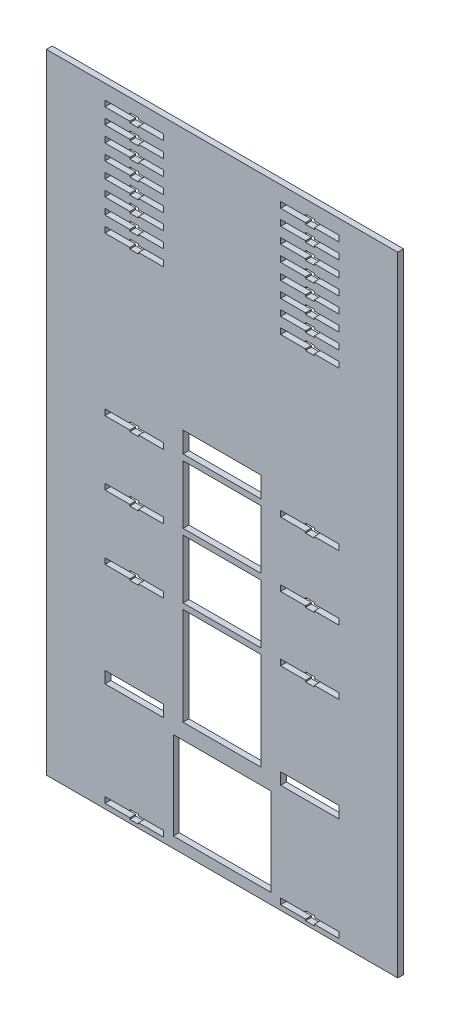
from build123d import *

# Parameters (mm, degrees)
SKETCH1_W                 = 180
SKETCH1_H                 = 322
SKETCH1_W_2               = 40
SKETCH1_H_2               = 130
SKETCH1_W_3               = 35
SKETCH1_H_3               = 27
PLATE_THICKNESS_3MM_DEPTH = 3
SKETCH2_W                 = 40
SKETCH2_H                 = 13.59171631
CUT_EXTRUDE1_DEPTH        = 15.24
SKETCH_1_W                = 50
SKETCH_1_H                = 45
CUT_EXTRUDE_1_DEPTH       = 255.576118283
SKETCH_2_W                = 40
SKETCH_2_H                = 3
SKETCH_2_H_2              = 2.910055408
SKETCH_2_H_3              = 8
EXTRUDE_1_DEPTH           = 3
SKETCH_3_W                = 30
SKETCH_3_H                = 6
CUT_EXTRUDE_2_DEPTH       = 255.576118283
SKETCH_3_3_W              = 4.5
SKETCH_3_3_H              = 0.75
EXTRUDE_2_DEPTH           = 3


with BuildPart() as part:
    # Sketch1 → Plate_thickness_3mm (new body)
    with BuildSketch(Plane.XY):
        with Locations((90, -19)):
            Rectangle(SKETCH1_W, SKETCH1_H)
        Polygon((30, -174.5), (30, -177.5), (42.75, -177.5), (42.75, -178.25), (47.25, -178.25), (47.25, -177.5), (60, -177.5), (60, -174.5), (47.25, -174.5), (47.25, -173.75), (42.75, -173.75), (42.75, -174.5), align=None, mode=Mode.SUBTRACT)
        Polygon((30, -121.5), (30, -124.5), (42.75, -124.5), (42.75, -125.25), (47.25, -125.25), (47.25, -124.5), (60, -124.5), (60, -121.5), (47.25, -121.5), (47.25, -120.75), (42.75, -120.75), (42.75, -121.5), align=None, mode=Mode.SUBTRACT)
        Polygon((30, -68.5), (30, -71.5), (42.75, -71.5), (42.75, -72.25), (47.25, -72.25), (47.25, -71.5), (60, -71.5), (60, -68.5), (47.25, -68.5), (47.25, -67.75), (42.75, -67.75), (42.75, -68.5), align=None, mode=Mode.SUBTRACT)
        Polygon((30, -35.5), (30, -38.5), (42.75, -38.5), (42.75, -39.25), (47.25, -39.25), (47.25, -38.5), (60, -38.5), (60, -35.5), (47.25, -35.5), (47.25, -34.75), (42.75, -34.75), (42.75, -35.5), align=None, mode=Mode.SUBTRACT)
        with Locations((90, -70.5)):
            Rectangle(SKETCH1_W_2, SKETCH1_H_2, mode=Mode.SUBTRACT)
        with Locations((90, -161)):
            Rectangle(SKETCH1_W_3, SKETCH1_H_3, mode=Mode.SUBTRACT)
        Polygon((120, -174.5), (120, -177.5), (132.75, -177.5), (132.75, -178.25), (137.25, -178.25), (137.25, -177.5), (150, -177.5), (150, -174.5), (137.25, -174.5), (137.25, -173.75), (132.75, -173.75), (132.75, -174.5), align=None, mode=Mode.SUBTRACT)
        Polygon((150, -121.5), (137.25, -121.5), (137.25, -120.75), (132.75, -120.75), (132.75, -121.5), (120, -121.5), (120, -124.5), (132.75, -124.5), (132.75, -125.25), (137.25, -125.25), (137.25, -124.5), (150, -124.5), align=None, mode=Mode.SUBTRACT)
        Polygon((150, -68.5), (137.25, -68.5), (137.25, -67.75), (132.75, -67.75), (132.75, -68.5), (120, -68.5), (120, -71.5), (132.75, -71.5), (132.75, -72.25), (137.25, -72.25), (137.25, -71.5), (150, -71.5), align=None, mode=Mode.SUBTRACT)
        Polygon((150, -35.5), (137.25, -35.5), (137.25, -34.75), (132.75, -34.75), (132.75, -35.5), (120, -35.5), (120, -38.5), (132.75, -38.5), (132.75, -39.25), (137.25, -39.25), (137.25, -38.5), (150, -38.5), align=None, mode=Mode.SUBTRACT)
        Polygon((30, -2.5), (30, -5.5), (42.75, -5.5), (42.75, -6.25), (47.25, -6.25), (47.25, -5.5), (60, -5.5), (60, -2.5), (47.25, -2.5), (47.25, -1.75), (42.75, -1.75), (42.75, -2.5), align=None, mode=Mode.SUBTRACT)
        Polygon((60, 75.5), (60, 78.5), (47.25, 78.5), (47.25, 79.25), (42.75, 79.25), (42.75, 78.5), (30, 78.5), (30, 75.5), (42.75, 75.5), (42.75, 74.75), (47.25, 74.75), (47.25, 75.5), align=None, mode=Mode.SUBTRACT)
        Polygon((60, 83.5), (60, 86.5), (47.25, 86.5), (47.25, 87.25), (42.75, 87.25), (42.75, 86.5), (30, 86.5), (30, 83.5), (42.75, 83.5), (42.75, 82.75), (47.25, 82.75), (47.25, 83.5), align=None, mode=Mode.SUBTRACT)
        Polygon((60, 91.5), (60, 94.5), (47.25, 94.5), (47.25, 95.25), (42.75, 95.25), (42.75, 94.5), (30, 94.5), (30, 91.5), (42.75, 91.5), (42.75, 90.75), (47.25, 90.75), (47.25, 91.5), align=None, mode=Mode.SUBTRACT)
        Polygon((60, 99.5), (60, 102.5), (47.25, 102.5), (47.25, 103.25), (42.75, 103.25), (42.75, 102.5), (30, 102.5), (30, 99.5), (42.75, 99.5), (42.75, 98.75), (47.25, 98.75), (47.25, 99.5), align=None, mode=Mode.SUBTRACT)
        Polygon((60, 107.5), (60, 110.5), (47.25, 110.5), (47.25, 111.25), (42.75, 111.25), (42.75, 110.5), (30, 110.5), (30, 107.5), (42.75, 107.5), (42.75, 106.75), (47.25, 106.75), (47.25, 107.5), align=None, mode=Mode.SUBTRACT)
        Polygon((60, 115.5), (60, 118.5), (47.25, 118.5), (47.25, 119.25), (42.75, 119.25), (42.75, 118.5), (30, 118.5), (30, 115.5), (42.75, 115.5), (42.75, 114.75), (47.25, 114.75), (47.25, 115.5), align=None, mode=Mode.SUBTRACT)
        Polygon((60, 123.5), (60, 126.5), (47.25, 126.5), (47.25, 127.25), (42.75, 127.25), (42.75, 126.5), (30, 126.5), (30, 123.5), (42.75, 123.5), (42.75, 122.75), (47.25, 122.75), (47.25, 123.5), align=None, mode=Mode.SUBTRACT)
        Polygon((60, 131.5), (60, 134.5), (47.25, 134.5), (47.25, 135.25), (42.75, 135.25), (42.75, 134.5), (30, 134.5), (30, 131.5), (42.75, 131.5), (42.75, 130.75), (47.25, 130.75), (47.25, 131.5), align=None, mode=Mode.SUBTRACT)
        Polygon((150, -2.5), (137.25, -2.5), (137.25, -1.75), (132.75, -1.75), (132.75, -2.5), (120, -2.5), (120, -5.5), (132.75, -5.5), (132.75, -6.25), (137.25, -6.25), (137.25, -5.5), (150, -5.5), align=None, mode=Mode.SUBTRACT)
        Polygon((150, 75.5), (150, 78.5), (137.25, 78.5), (137.25, 79.25), (132.75, 79.25), (132.75, 78.5), (120, 78.5), (120, 75.5), (132.75, 75.5), (132.75, 74.75), (137.25, 74.75), (137.25, 75.5), align=None, mode=Mode.SUBTRACT)
        Polygon((150, 83.5), (150, 86.5), (137.25, 86.5), (137.25, 87.25), (132.75, 87.25), (132.75, 86.5), (120, 86.5), (120, 83.5), (132.75, 83.5), (132.75, 82.75), (137.25, 82.75), (137.25, 83.5), align=None, mode=Mode.SUBTRACT)
        Polygon((150, 91.5), (150, 94.5), (137.25, 94.5), (137.25, 95.25), (132.75, 95.25), (132.75, 94.5), (120, 94.5), (120, 91.5), (132.75, 91.5), (132.75, 90.75), (137.25, 90.75), (137.25, 91.5), align=None, mode=Mode.SUBTRACT)
        Polygon((150, 99.5), (150, 102.5), (137.25, 102.5), (137.25, 103.25), (132.75, 103.25), (132.75, 102.5), (120, 102.5), (120, 99.5), (132.75, 99.5), (132.75, 98.75), (137.25, 98.75), (137.25, 99.5), align=None, mode=Mode.SUBTRACT)
        Polygon((150, 107.5), (150, 110.5), (137.25, 110.5), (137.25, 111.25), (132.75, 111.25), (132.75, 110.5), (120, 110.5), (120, 107.5), (132.75, 107.5), (132.75, 106.75), (137.25, 106.75), (137.25, 107.5), align=None, mode=Mode.SUBTRACT)
        Polygon((150, 115.5), (150, 118.5), (137.25, 118.5), (137.25, 119.25), (132.75, 119.25), (132.75, 118.5), (120, 118.5), (120, 115.5), (132.75, 115.5), (132.75, 114.75), (137.25, 114.75), (137.25, 115.5), align=None, mode=Mode.SUBTRACT)
        Polygon((150, 123.5), (150, 126.5), (137.25, 126.5), (137.25, 127.25), (132.75, 127.25), (132.75, 126.5), (120, 126.5), (120, 123.5), (132.75, 123.5), (132.75, 122.75), (137.25, 122.75), (137.25, 123.5), align=None, mode=Mode.SUBTRACT)
        Polygon((150, 131.5), (150, 134.5), (137.25, 134.5), (137.25, 135.25), (132.75, 135.25), (132.75, 134.5), (120, 134.5), (120, 131.5), (132.75, 131.5), (132.75, 130.75), (137.25, 130.75), (137.25, 131.5), align=None, mode=Mode.SUBTRACT)
    extrude(amount=PLATE_THICKNESS_3MM_DEPTH)

    # Sketch2 → Cut-Extrude1 (cut)
    with BuildSketch(Plane.XY.offset(3)):
        with Locations((90, 1.295858155)):
            Rectangle(SKETCH2_W, SKETCH2_H)
    extrude(amount=-CUT_EXTRUDE1_DEPTH, mode=Mode.SUBTRACT)

    # 草图1 → 切除-拉伸1 (cut, through all)
    with BuildSketch(Plane.XY.offset(3)):
        with Locations((90, -152)):
            Rectangle(SKETCH_1_W, SKETCH_1_H)
    extrude(amount=-CUT_EXTRUDE_1_DEPTH, mode=Mode.SUBTRACT)

    # 草图2 → 凸台-拉伸1 (add)
    with BuildSketch(Plane.XY.offset(3)):
        with Locations((90, -4)):
            Rectangle(SKETCH_2_W, SKETCH_2_H)
        with Locations((90, -37)):
            Rectangle(SKETCH_2_W, SKETCH_2_H)
        with Locations((90, -70.044972296)):
            Rectangle(SKETCH_2_W, SKETCH_2_H_2)
        with Locations((90, -125.5)):
            Rectangle(SKETCH_2_W, SKETCH_2_H_3)
    extrude(amount=-EXTRUDE_1_DEPTH)

    # 草图3 → 切除-拉伸2 (cut, through all)
    with BuildSketch(Plane.XY.offset(3)):
        with Locations((45, -121.5)):
            Rectangle(SKETCH_3_W, SKETCH_3_H)
        Polygon((132.75, -124.5), (137.25, -124.5), (150, -124.5), (150, -118.5), (120, -118.5), (120, -124.5), align=None)
    extrude(amount=-CUT_EXTRUDE_2_DEPTH, mode=Mode.SUBTRACT)

    # 草图3<3> → 凸台-拉伸2 (add)
    with BuildSketch(Plane.XY.offset(3)):
        with Locations((45, -124.875)):
            Rectangle(SKETCH_3_3_W, SKETCH_3_3_H)
        with Locations((135, -124.875)):
            Rectangle(SKETCH_3_3_W, SKETCH_3_3_H)
    extrude(amount=-EXTRUDE_2_DEPTH)


solid = part.part
